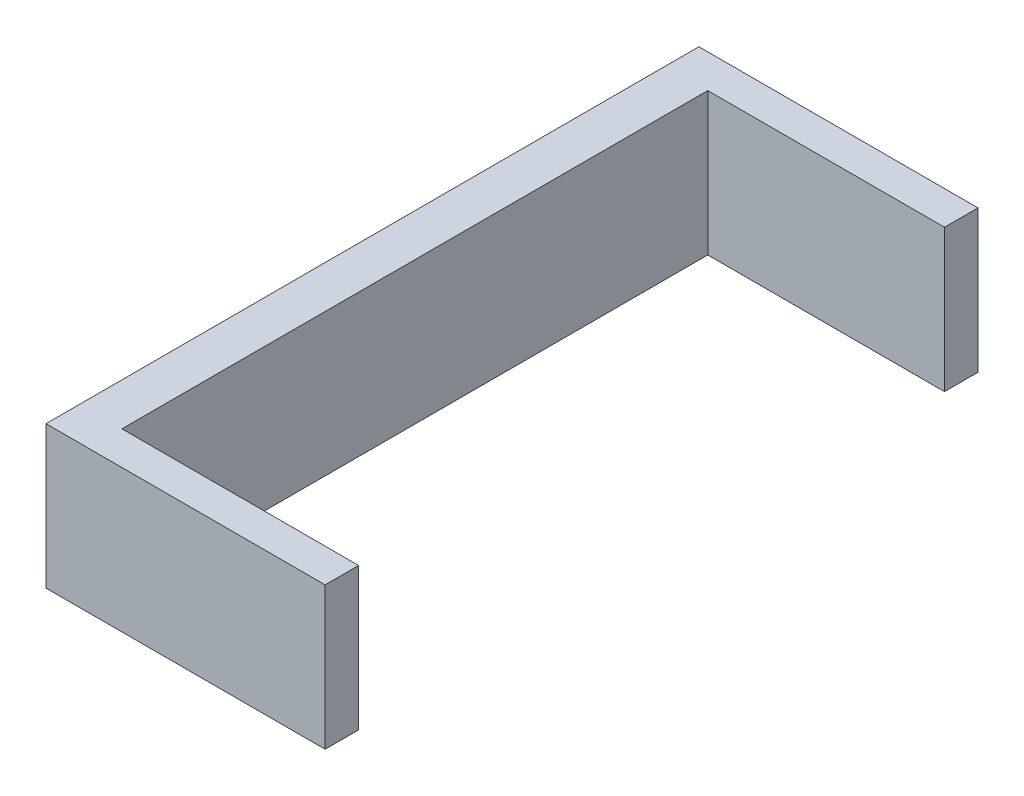
from build123d import *

# Parameters (mm, degrees)
BOSS_EXTRUDE1_DEPTH = 26.924


with BuildPart() as part:
    # Sketch1 → Boss-Extrude1 (new, symmetric)
    with BuildSketch(Plane(origin=(0, 0, 0), x_dir=(1, 0, 0), z_dir=(0, 1, 0))):
        Polygon((-16.038691669, 65.646737994), (0, 65.646737994), (0, -45.132132371), (89.518279083, -45.132132371), (89.518279083, -57.813888574), (-16.038691669, -57.813888574), (-16.038691669, -45.132132371), align=None)
    boss_extrude1 = extrude(amount=BOSS_EXTRUDE1_DEPTH, both=True)

    # Mirror1: Boss-Extrude1 across plane
    add(boss_extrude1.mirror(Plane(origin=(-16.038691669, 26.924, -65.646737994), x_dir=(1, 0, 0), z_dir=(0, 0, 1))))


solid = part.part
